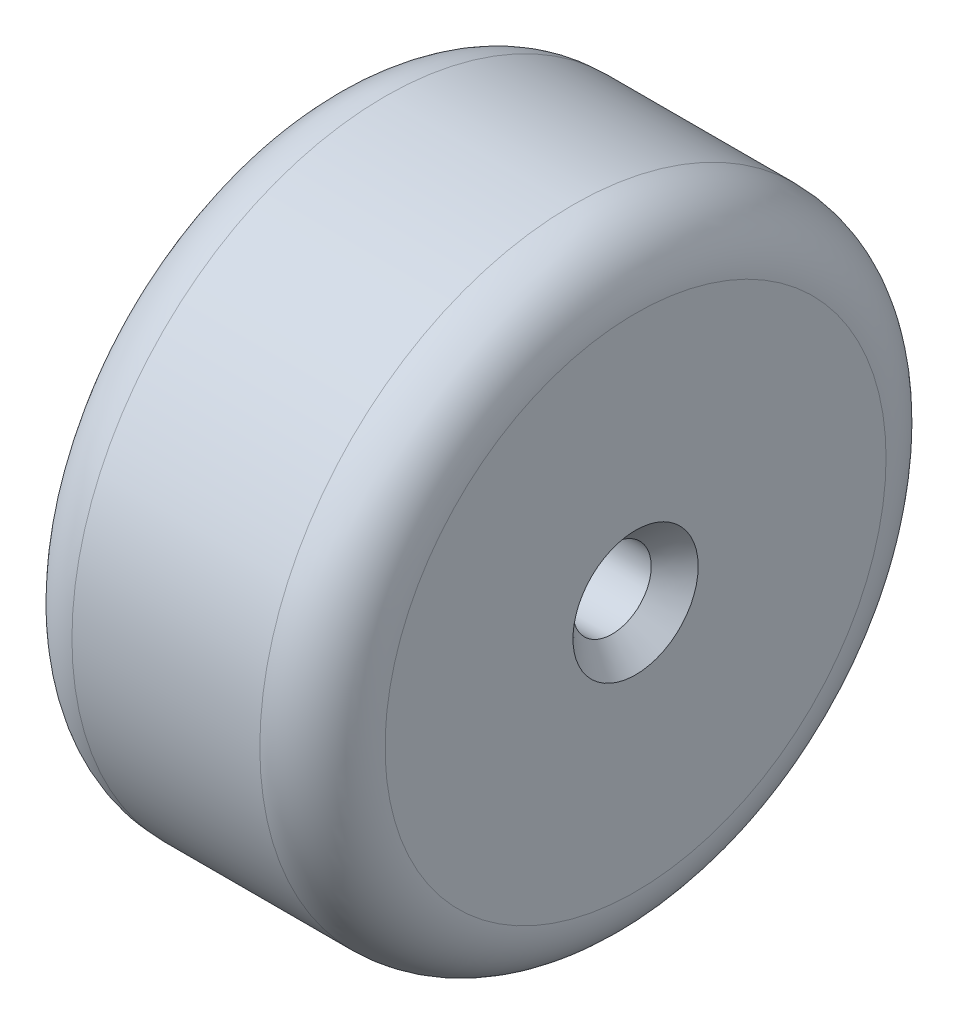
from build123d import *

# Parameters (mm, degrees)
SKETCH1_R           = 40
BOSS_EXTRUDE1_DEPTH = 40
FILLET1_R           = 8
SKETCH2_R           = 5
CUT_EXTRUDE1_DEPTH  = 70.28203236
CHAMFER1_SIZE       = 3


with BuildPart() as part:
    # Sketch1 → Boss-Extrude1 (new body)
    with BuildSketch(Plane(origin=(0, 0, 0), x_dir=(0, 0, -1), z_dir=(1, 0, 0))):
        Circle(SKETCH1_R)
    extrude(amount=BOSS_EXTRUDE1_DEPTH)

    # Fillet1
    fillet1_edges = [part.edges().sort_by_distance(p)[0] for p in [
        (0, 0, 40),
        (40, 0, 40),
    ]]
    fillet(fillet1_edges, radius=FILLET1_R)

    # Sketch2 → Cut-Extrude1 (cut, through all)
    with BuildSketch(Plane(origin=(40, 0, 0), x_dir=(0, 0, -1), z_dir=(1, 0, 0))):
        Circle(SKETCH2_R)
    extrude(amount=-CUT_EXTRUDE1_DEPTH, mode=Mode.SUBTRACT)

    # Chamfer1
    chamfer1_edges = [part.edges().sort_by_distance(p)[0] for p in [
        (0, 0, 5),
        (40, 0, 5),
    ]]
    chamfer(chamfer1_edges, length=CHAMFER1_SIZE)


solid = part.part
